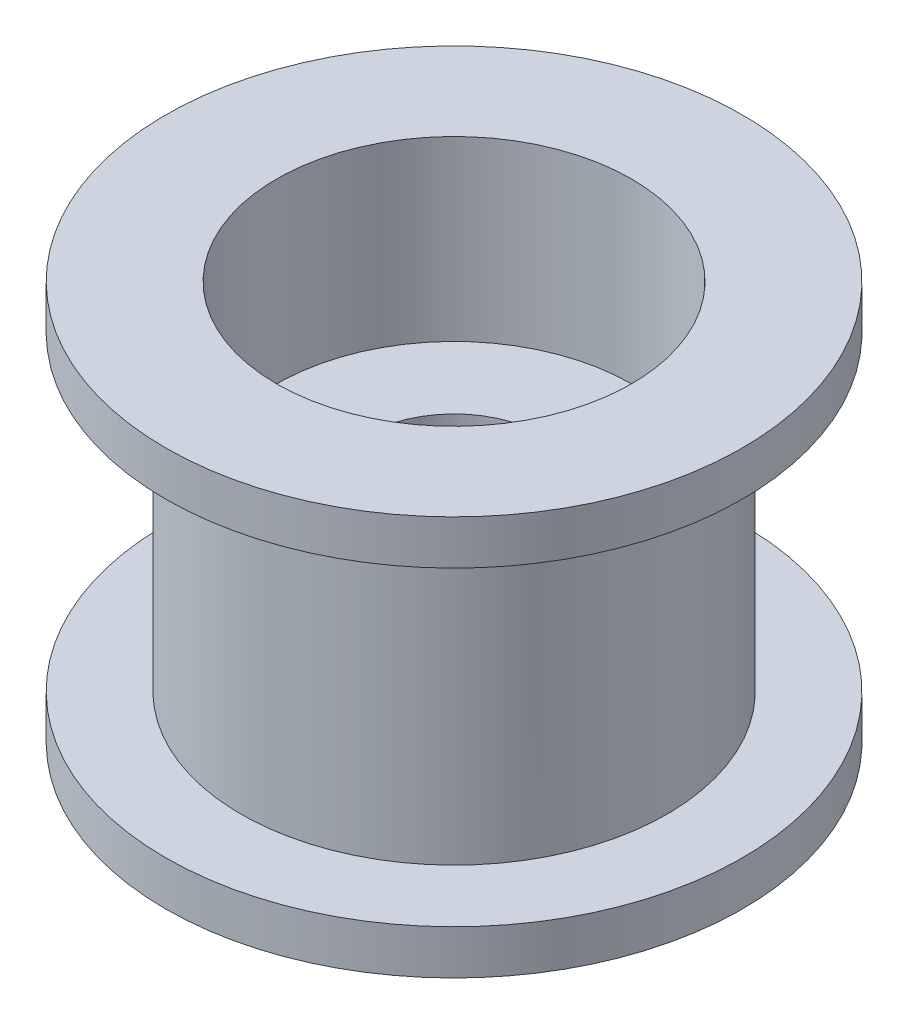
from build123d import *

# Parameters (mm, degrees)
SKETCH2_R           = 4.8
BOSS_EXTRUDE1_DEPTH = 3.5
SKETCH3_R           = 6.5
BOSS_EXTRUDE2_DEPTH = 1
SKETCH4_R           = 4
CUT_EXTRUDE1_DEPTH  = 4
SKETCH5_R           = 2
CUT_EXTRUDE2_DEPTH  = 11.464224768


with BuildPart() as part:
    # Sketch2 → Boss-Extrude1 (new, symmetric)
    with BuildSketch(Plane(origin=(0, 0, 0), x_dir=(1, 0, 0), z_dir=(0, 1, 0))):
        with Locations(Location((0, 0, 0), (0, 0, 270))):
            Circle(SKETCH2_R)
    extrude(amount=BOSS_EXTRUDE1_DEPTH, both=True)

    # Sketch3 → Boss-Extrude2 (add)
    with BuildSketch(Plane(origin=(0, 3.5, 0), x_dir=(1, 0, 0), z_dir=(0, 1, 0))):
        with Locations(Location((0, 0, 0), (0, 0, 270))):
            Circle(SKETCH3_R)
    boss_extrude2 = extrude(amount=BOSS_EXTRUDE2_DEPTH)

    # Sketch4 → Cut-Extrude1 (cut)
    with BuildSketch(Plane(origin=(0, 4.5, 0), x_dir=(1, 0, 0), z_dir=(0, 1, 0))):
        with Locations(Location((0, 0, 0), (0, 0, 270))):
            Circle(SKETCH4_R)
    cut_extrude1 = extrude(amount=-CUT_EXTRUDE1_DEPTH, mode=Mode.SUBTRACT)

    # Mirror1: Boss-Extrude2, Cut-Extrude1 across plane
    add(boss_extrude2.mirror(Plane.ZX))
    add(cut_extrude1.mirror(Plane.ZX), mode=Mode.SUBTRACT)

    # Sketch5 → Cut-Extrude2 (cut, through all)
    with BuildSketch(Plane(origin=(0, 0.5, 0), x_dir=(1, 0, 0), z_dir=(0, 1, 0))):
        with Locations(Location((0, 0, 0), (0, 0, 270))):
            Circle(SKETCH5_R)
    extrude(amount=-CUT_EXTRUDE2_DEPTH, mode=Mode.SUBTRACT)


solid = part.part
